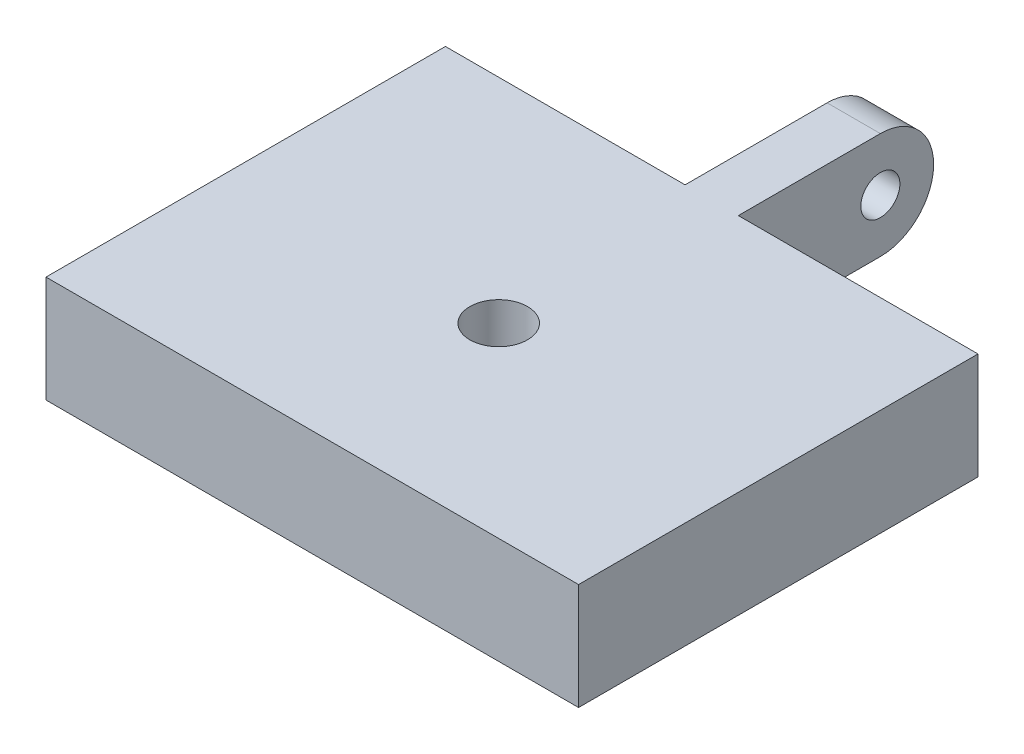
from build123d import *

# Parameters (mm, degrees)
CROQUIS_LENGUETA_BUJE_R        = 6
LENGUETA_BUJE_DEPTH            = 3
CROQUIS_LENGUETA_W             = 18
CROQUIS_LENGUETA_H             = 12
LENGUETA_DEPTH                 = 3
CROQUIS_CEJA_W                 = 60
CROQUIS_CEJA_H                 = 45
CEJA_MONITOR_DEPTH             = 12
AGUJERO_TRIPODE_1_4_DEPTH      = 69.242215673
AGUJERO_TRIPODE_1_4_DEPTH_BACK = 69.242215673
CROQUIS_ROSCA_R                = 3.25
EJE_M4_DEPTH                   = 69.242215673
EJE_M4_DEPTH_BACK              = 69.242215673
CROQUIS_EJE_R                  = 2.2


with BuildPart() as part:
    # Croquis_lengueta_buje → Lengueta_buje (new, symmetric)
    with BuildSketch(Plane(origin=(0, 0, 0), x_dir=(0, 0, -1), z_dir=(1, 0, 0))):
        Circle(CROQUIS_LENGUETA_BUJE_R)
    extrude(amount=LENGUETA_BUJE_DEPTH, both=True)

    # Croquis_lengueta → Lengueta (add, symmetric)
    with BuildSketch(Plane(origin=(0, 0, 0), x_dir=(0, 0, -1), z_dir=(1, 0, 0))):
        with Locations((-9, 0)):
            Rectangle(CROQUIS_LENGUETA_W, CROQUIS_LENGUETA_H)
    extrude(amount=LENGUETA_DEPTH, both=True)

    # Croquis_ceja → Ceja_monitor (add)
    with BuildSketch(Plane(origin=(0, -6, 0), x_dir=(1, 0, 0), z_dir=(0, 1, 0))):
        with Locations((0, -38.5)):
            Rectangle(CROQUIS_CEJA_W, CROQUIS_CEJA_H)
    extrude(amount=CEJA_MONITOR_DEPTH)

    # Croquis_rosca → Agujero_tripode_1_4 (cut, two sides: drawn at the far end of the back side and taken through both)
    with BuildSketch(Plane(origin=(0, 0, 0), x_dir=(1, 0, 0), z_dir=(0, 1, 0)).offset(-AGUJERO_TRIPODE_1_4_DEPTH_BACK)):
        with Locations(Location((0, -40, 0), (0, 0, 270))):
            Circle(CROQUIS_ROSCA_R)
    extrude(amount=AGUJERO_TRIPODE_1_4_DEPTH + AGUJERO_TRIPODE_1_4_DEPTH_BACK, mode=Mode.SUBTRACT)

    # Croquis_eje → Eje_M4 (cut, two sides: drawn at the far end of the back side and taken through both)
    with BuildSketch(Plane(origin=(0, 0, 0), x_dir=(0, 0, -1), z_dir=(1, 0, 0)).offset(-EJE_M4_DEPTH_BACK)):
        Circle(CROQUIS_EJE_R)
    extrude(amount=EJE_M4_DEPTH + EJE_M4_DEPTH_BACK, mode=Mode.SUBTRACT)


solid = part.part
